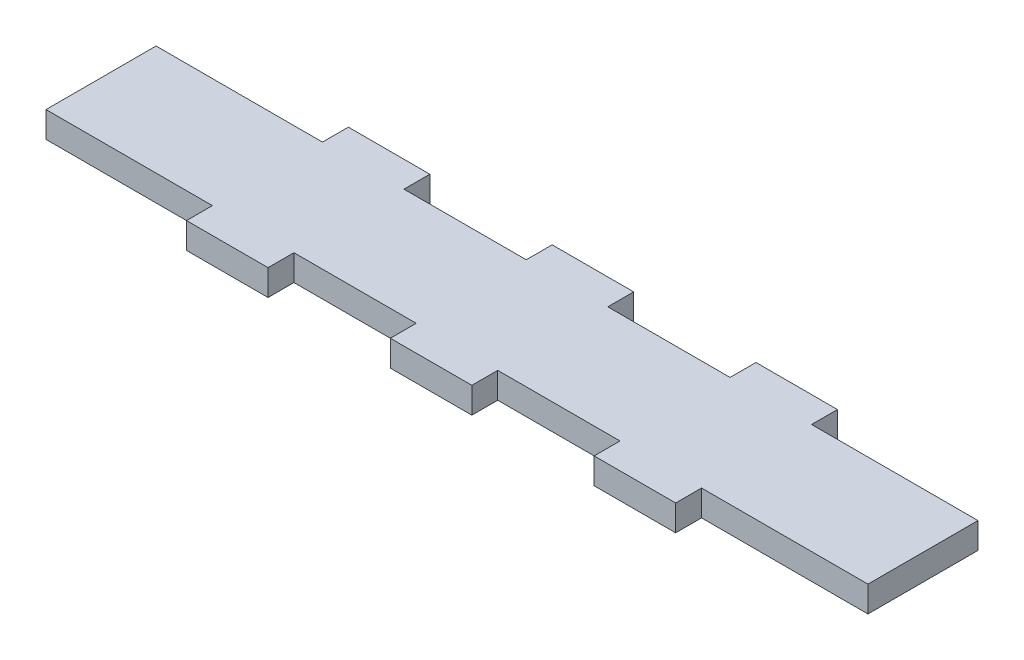
from build123d import *

# Parameters (mm, degrees)
BOSS_EXTRUDE1_DEPTH = 6.35


with BuildPart() as part:
    # Sketch1 → Boss-Extrude1 (new body)
    with BuildSketch(Plane(origin=(0, 0, 0), x_dir=(1, 0, 0), z_dir=(0, 1, 0))):
        Polygon((-100.825, 13.5), (-60, 13.5), (-60, 19.85), (-40, 19.85), (-40, 13.5), (-10, 13.5), (-10, 19.85), (10, 19.85), (10, 13.5), (40, 13.5), (40, 19.85), (60, 19.85), (60, 13.5), (100.825, 13.5), (100.825, -13.5), (60, -13.5), (60, -19.85), (40, -19.85), (40, -13.5), (10, -13.5), (10, -19.85), (-10, -19.85), (-10, -13.5), (-40, -13.5), (-40, -19.85), (-60, -19.85), (-60, -13.5), (-100.825, -13.5), align=None)
    extrude(amount=BOSS_EXTRUDE1_DEPTH)


solid = part.part
